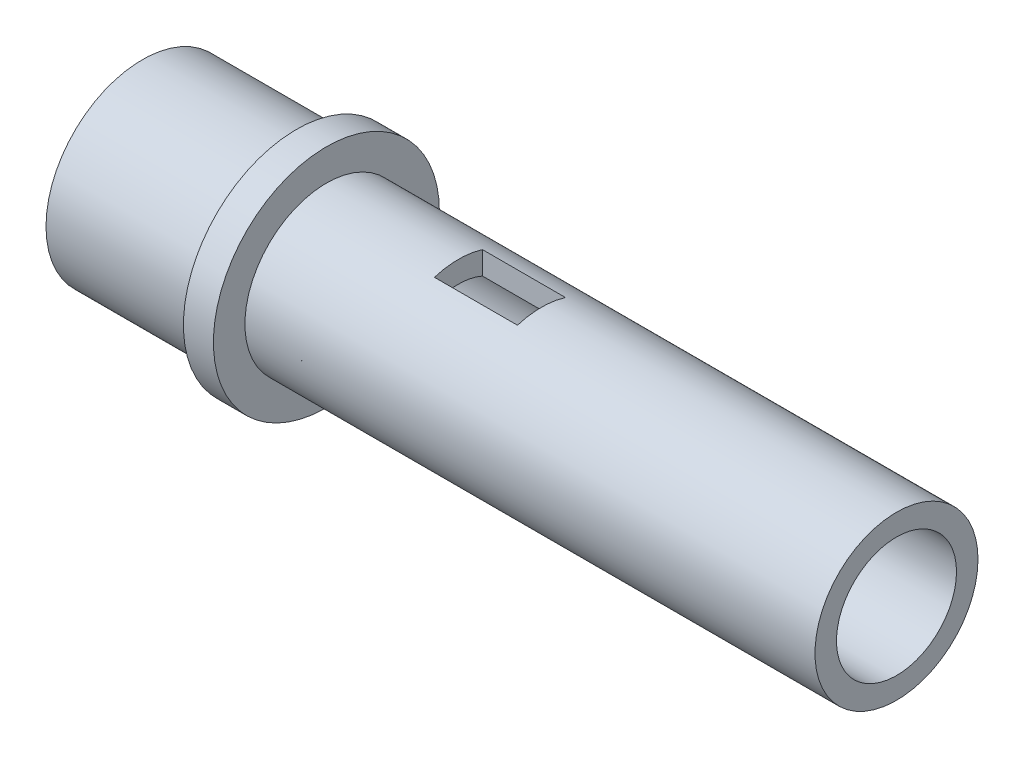
from build123d import *

# Parameters (mm, degrees)
SKETCH1_R           = 4.82
BOSS_EXTRUDE1_DEPTH = 7.7
SKETCH2_R           = 5.65
BOSS_EXTRUDE2_DEPTH = 1.5
SKETCH3_R           = 4.075
BOSS_EXTRUDE3_DEPTH = 28.5
SKETCH4_R           = 3
CUT_EXTRUDE1_DEPTH  = 39.537449319
SKETCH5_R           = 3.95
CUT_EXTRUDE2_DEPTH  = 7.7
SKETCH6_W           = 4.15
SKETCH6_H           = 2.4
CUT_EXTRUDE3_DEPTH  = 7.7


with BuildPart() as part:
    # Sketch1 → Boss-Extrude1 (new body)
    with BuildSketch(Plane(origin=(0, 0, 0), x_dir=(0, 0, -1), z_dir=(1, 0, 0))):
        with Locations(Location((0, 0, 0), (0, 0, 180))):
            Circle(SKETCH1_R)
    extrude(amount=BOSS_EXTRUDE1_DEPTH)

    # Sketch2 → Boss-Extrude2 (add)
    with BuildSketch(Plane(origin=(7.7, 0, 0), x_dir=(0, 0, -1), z_dir=(1, 0, 0))):
        Circle(SKETCH2_R)
    extrude(amount=BOSS_EXTRUDE2_DEPTH)

    # Sketch3 → Boss-Extrude3 (add)
    with BuildSketch(Plane(origin=(9.2, 0, 0), x_dir=(0, 0, -1), z_dir=(1, 0, 0))):
        with Locations(Location((0, 0, 0), (0, 0, 180))):
            Circle(SKETCH3_R)
    extrude(amount=BOSS_EXTRUDE3_DEPTH)

    # Sketch4 → Cut-Extrude1 (cut, through all)
    with BuildSketch(Plane(origin=(37.7, 0, 0), x_dir=(0, 0, -1), z_dir=(1, 0, 0))):
        Circle(SKETCH4_R)
    extrude(amount=-CUT_EXTRUDE1_DEPTH, mode=Mode.SUBTRACT)

    # Sketch5 → Cut-Extrude2 (cut)
    with BuildSketch(Plane.ZY):
        Circle(SKETCH5_R)
    extrude(amount=-CUT_EXTRUDE2_DEPTH, mode=Mode.SUBTRACT)

    # Sketch6 → Cut-Extrude3 (cut)
    with BuildSketch(Plane(origin=(0, 0, 0), x_dir=(1, 0, 0), z_dir=(0, 1, 0))):
        with Locations((17.875, 0)):
            Rectangle(SKETCH6_W, SKETCH6_H)
    extrude(amount=CUT_EXTRUDE3_DEPTH, mode=Mode.SUBTRACT)


solid = part.part
